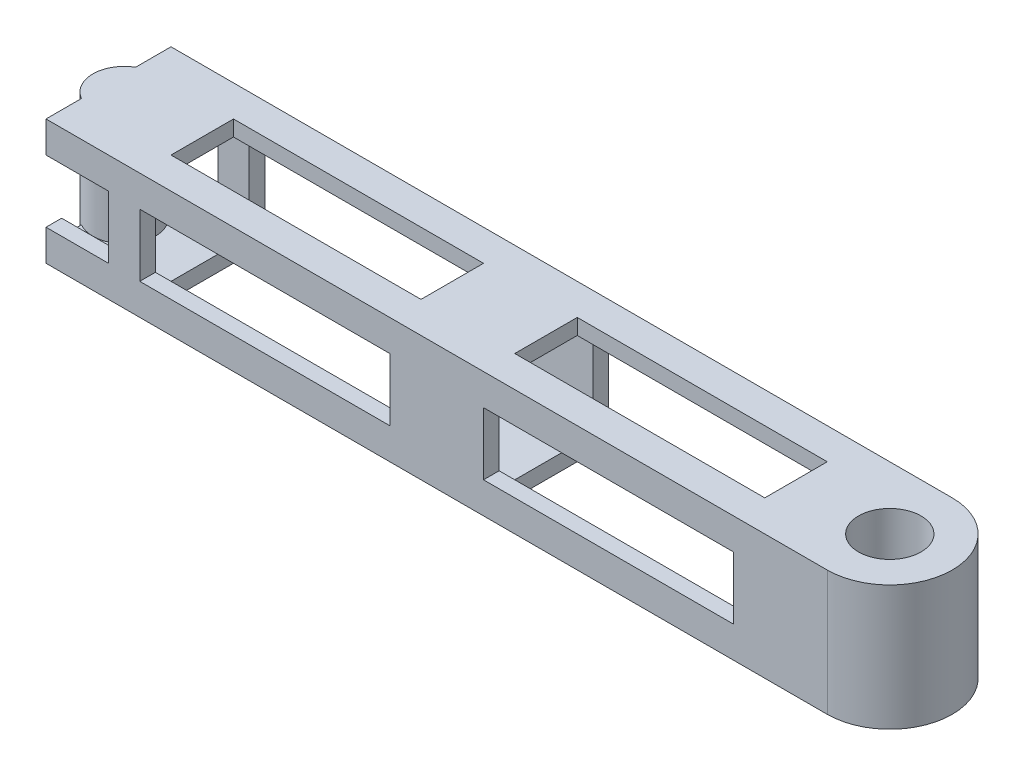
from build123d import *

# Parameters (mm, degrees)
SKETCH1_W               = 250
SKETCH1_H               = 40
BOSS_EXTRUDE1_DEPTH     = 40
CUT_EXTRUDE1_DEPTH      = 278.634133017
CUT_EXTRUDE1_DEPTH_BACK = 278.634133017
SKETCH2_W               = 30
SKETCH2_H               = 30
CUT_EXTRUDE2_DEPTH      = 178.338713683
CUT_EXTRUDE2_DEPTH_BACK = 178.338713683
SKETCH3_W               = 80
SKETCH3_H               = 20
CUT_EXTRUDE3_DEPTH      = 142.662654059
CUT_EXTRUDE3_DEPTH_BACK = 142.662654059
SKETCH4_W               = 80
SKETCH4_H               = 20
CUT_EXTRUDE4_DEPTH      = 178.338713683
CUT_EXTRUDE4_DEPTH_BACK = 178.338713683
SKETCH5_W               = 20
SKETCH5_H               = 20
SKETCH6_R               = 10
BOSS_EXTRUDE2_DEPTH     = 40
SKETCH7_R               = 20
BOSS_EXTRUDE3_DEPTH     = 40
CUT_EXTRUDE5_DEPTH      = 161.198094577
CUT_EXTRUDE5_DEPTH_BACK = 161.198094577
SKETCH8_R               = 10


with BuildPart() as part:
    # Sketch1 → Boss-Extrude1 (new body)
    with BuildSketch(Plane.XY):
        with Locations((4.87804878, -93.932926829)):
            Rectangle(SKETCH1_W, SKETCH1_H)
    extrude(amount=BOSS_EXTRUDE1_DEPTH)

    # Sketch2 → Cut-Extrude1 (cut, two sides: drawn at the far end of the back side and taken through both)
    with BuildSketch(Plane(origin=(129.87804878, 0, 0), x_dir=(0, 0, -1), z_dir=(1, 0, 0)).offset(-CUT_EXTRUDE1_DEPTH_BACK)):
        with Locations((-20, -93.932926829)):
            Rectangle(SKETCH2_W, SKETCH2_H)
    extrude(amount=CUT_EXTRUDE1_DEPTH + CUT_EXTRUDE1_DEPTH_BACK, mode=Mode.SUBTRACT)

    # Sketch3 → Cut-Extrude2 (cut, two sides: drawn at the far end of the back side and taken through both)
    with BuildSketch(Plane(origin=(0, 0, 0), x_dir=(-1, 0, 0), z_dir=(0, 0, -1)).offset(-CUT_EXTRUDE2_DEPTH_BACK)):
        with Locations((-59.87804878, -93.932926829)):
            Rectangle(SKETCH3_W, SKETCH3_H)
        with Locations((50.12195122, -93.932926829)):
            Rectangle(SKETCH3_W, SKETCH3_H)
    extrude(amount=CUT_EXTRUDE2_DEPTH + CUT_EXTRUDE2_DEPTH_BACK, mode=Mode.SUBTRACT)

    # Sketch4 → Cut-Extrude3 (cut, two sides: drawn at the far end of the back side and taken through both)
    with BuildSketch(Plane(origin=(0, -73.932926829, 0), x_dir=(1, 0, 0), z_dir=(0, 1, 0)).offset(-CUT_EXTRUDE3_DEPTH_BACK)):
        with Locations((59.87804878, -20)):
            Rectangle(SKETCH4_W, SKETCH4_H)
        with Locations((-50.12195122, -20)):
            Rectangle(SKETCH4_W, SKETCH4_H)
    extrude(amount=CUT_EXTRUDE3_DEPTH + CUT_EXTRUDE3_DEPTH_BACK, mode=Mode.SUBTRACT)

    # Sketch5 → Cut-Extrude4 (cut, two sides: drawn at the far end of the back side and taken through both)
    with BuildSketch(Plane.XY.offset(40).offset(-CUT_EXTRUDE4_DEPTH_BACK)):
        with Locations((-110.12195122, -93.932926829)):
            Rectangle(SKETCH5_W, SKETCH5_H)
    extrude(amount=CUT_EXTRUDE4_DEPTH + CUT_EXTRUDE4_DEPTH_BACK, mode=Mode.SUBTRACT)

    # Sketch6 → Boss-Extrude2 (add)
    with BuildSketch(Plane.XZ.offset(113.932926829)):
        with Locations(Location((-115.12195122, 20, 0), (0, 0, 240))):
            Circle(SKETCH6_R)
    extrude(amount=-BOSS_EXTRUDE2_DEPTH)

    # Sketch7 → Boss-Extrude3 (add)
    with BuildSketch(Plane.XZ.offset(113.932926829)):
        with Locations((129.87804878, 20)):
            Circle(SKETCH7_R)
    extrude(amount=-BOSS_EXTRUDE3_DEPTH)

    # Sketch8 → Cut-Extrude5 (cut, two sides: drawn at the far end of the back side and taken through both)
    with BuildSketch(Plane(origin=(0, -113.932926829, 0), x_dir=(-1, 0, 0), z_dir=(0, -1, 0)).offset(-CUT_EXTRUDE5_DEPTH_BACK)):
        with Locations(Location((-129.87804878, -20, 0), (0, 0, 90))):
            Circle(SKETCH8_R)
    extrude(amount=CUT_EXTRUDE5_DEPTH + CUT_EXTRUDE5_DEPTH_BACK, mode=Mode.SUBTRACT)


solid = part.part
